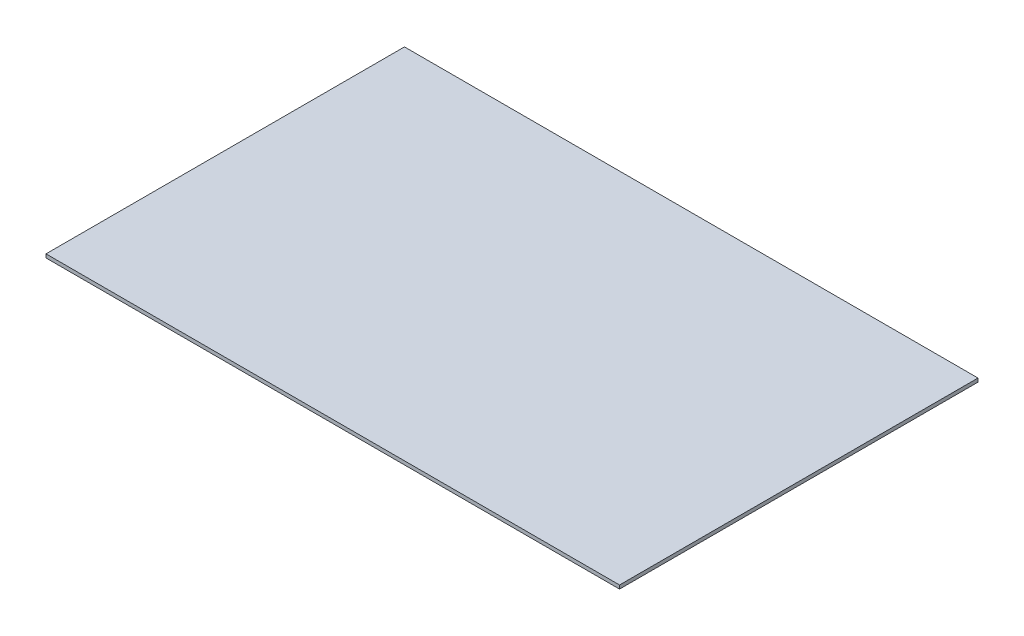
from build123d import *

# Parameters (mm, degrees)
ESQUISSE1_W        = 800
ESQUISSE1_H        = 500
BOSS_EXTRU_1_DEPTH = 5


with BuildPart() as part:
    # Esquisse1 → Boss.-Extru.1 (new body)
    with BuildSketch(Plane(origin=(0, 0, 0), x_dir=(1, 0, 0), z_dir=(0, 1, 0))):
        Rectangle(ESQUISSE1_W, ESQUISSE1_H)
    extrude(amount=BOSS_EXTRU_1_DEPTH)


solid = part.part
